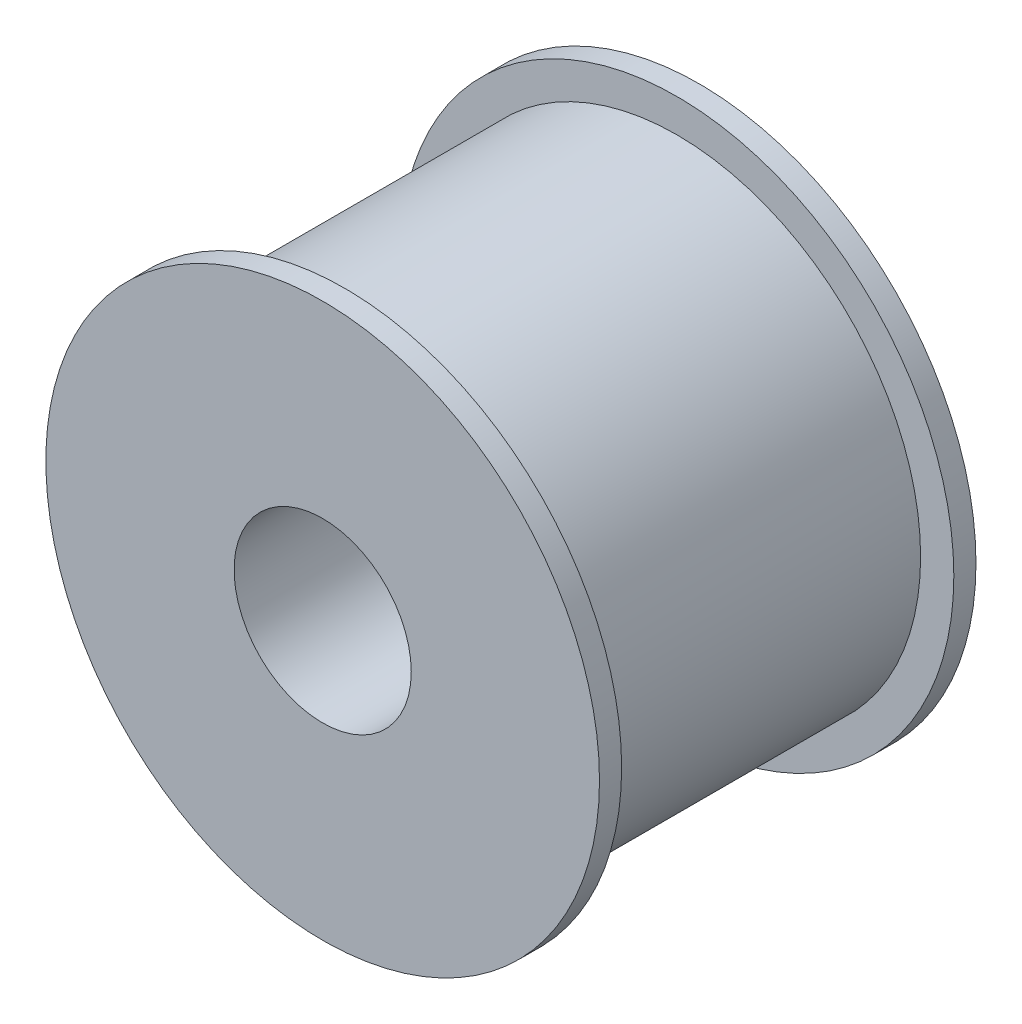
from build123d import *

# Parameters (mm, degrees)
SKETCH1_R           = 11
SKETCH1_R_2         = 4
BOSS_EXTRUDE1_DEPTH = 8
SKETCH2_R           = 12.5
SKETCH2_R_2         = 4
BOSS_EXTRUDE2_DEPTH = 0.5


with BuildPart() as part:
    # Sketch1 → Boss-Extrude1 (new, symmetric)
    with BuildSketch(Plane.XY):
        Circle(SKETCH1_R)
        Circle(SKETCH1_R_2, mode=Mode.SUBTRACT)
    extrude(amount=BOSS_EXTRUDE1_DEPTH, both=True)

    # Sketch2 → Boss-Extrude2 (add, symmetric)
    with BuildSketch(Plane.XY.offset(8)):
        Circle(SKETCH2_R)
        Circle(SKETCH2_R_2, mode=Mode.SUBTRACT)
    boss_extrude2 = extrude(amount=BOSS_EXTRUDE2_DEPTH, both=True)

    # Mirror1: Boss-Extrude2 across plane
    add(boss_extrude2.mirror(Plane.XY))


solid = part.part
